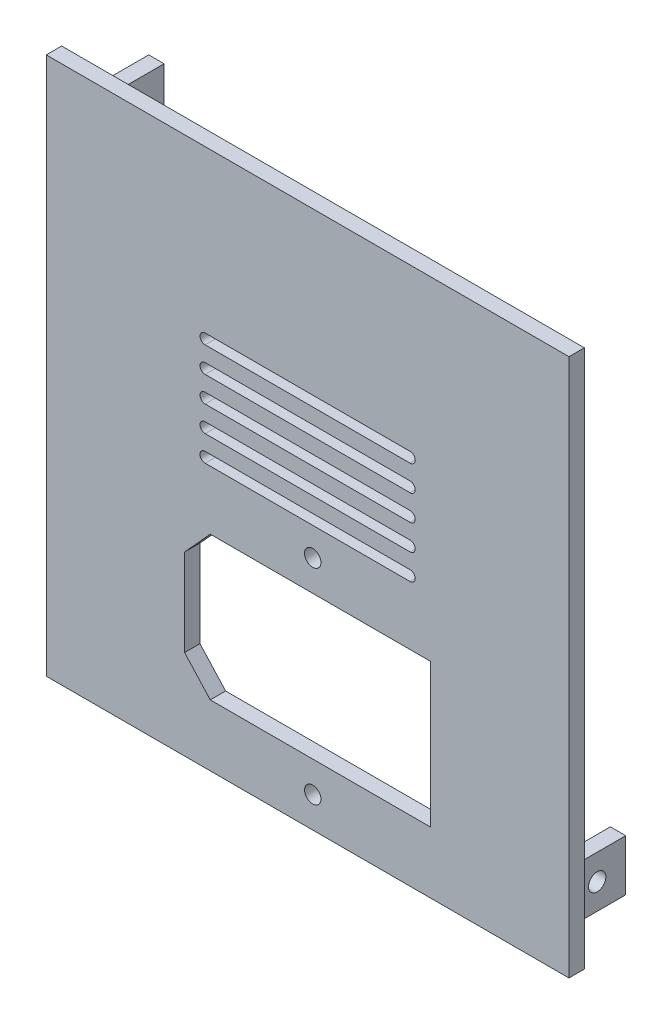
from build123d import *

# Parameters (mm, degrees)
SKETCH2_W            = 102
SKETCH2_H            = 105
BOSS_EXTRUDE1_DEPTH  = 1.5
CUT_EXTRUDE1_DEPTH   = 10
CUT_EXTRUDE2_DEPTH   = 10
SKETCH5_W            = 3
SKETCH5_H            = 10
BOSS_EXTRUDE2_DEPTH  = 17
FILLET1_R            = 3
M3_CLEARANCE_HOLE1_D = 3.4
SKETCH8_W            = 3
SKETCH8_H            = 10
BOSS_EXTRUDE3_DEPTH  = 15
M3_CLEARANCE_HOLE2_D = 3.4
FILLET2_R            = 3
FILLET3_R            = 1
FILLET1_OF_MIRROR1_R = 3
M3_CLEARANCE_HOLE3_D = 3.2


with BuildPart() as part:
    # Sketch2 → Boss-Extrude1 (new, symmetric)
    with BuildSketch(Plane.XY):
        Rectangle(SKETCH2_W, SKETCH2_H)
    extrude(amount=BOSS_EXTRUDE1_DEPTH, both=True)

    # Sketch3 → Cut-Extrude1 (cut)
    with BuildSketch(Plane.XY.offset(1.5)):
        with BuildLine():
            Line((-20, 1), (20, 1))
            ThreePointArc((20, 1), (21, 0), (20, -1))
            Line((20, -1), (-20, -1))
            ThreePointArc((-20, -1), (-21, 0), (-20, 1))
        make_face()
        with BuildLine():
            Line((-20, 6), (20, 6))
            ThreePointArc((20, 6), (21, 5), (20, 4))
            Line((20, 4), (-20, 4))
            ThreePointArc((-20, 4), (-21, 5), (-20, 6))
        make_face()
        with BuildLine():
            Line((-20, 11), (20, 11))
            ThreePointArc((20, 11), (21, 10), (20, 9))
            Line((20, 9), (-20, 9))
            ThreePointArc((-20, 9), (-21, 10), (-20, 11))
        make_face()
        with BuildLine():
            Line((-20, 16), (20, 16))
            ThreePointArc((20, 16), (21, 15), (20, 14))
            Line((20, 14), (-20, 14))
            ThreePointArc((-20, 14), (-21, 15), (-20, 16))
        make_face()
        with BuildLine():
            Line((-20, 21), (20, 21))
            ThreePointArc((20, 21), (21, 20), (20, 19))
            Line((20, 19), (-20, 19))
            ThreePointArc((-20, 19), (-21, 20), (-20, 21))
        make_face()
    extrude(amount=-CUT_EXTRUDE1_DEPTH, mode=Mode.SUBTRACT)

    # Sketch4 → Cut-Extrude2 (cut)
    with BuildSketch(Plane.XY.offset(1.5)):
        Polygon((-19, -12.5), (24, -12.5), (24, -40.5), (-19, -40.5), (-24, -35), (-24, -18), align=None)
    extrude(amount=-CUT_EXTRUDE2_DEPTH, mode=Mode.SUBTRACT)

    # Sketch5 → Boss-Extrude2 (add)
    with BuildSketch(Plane(origin=(0, 0, -1.5), x_dir=(-1, 0, 0), z_dir=(0, 0, -1))):
        with Locations((49.5, -37.5)):
            Rectangle(SKETCH5_W, SKETCH5_H)
    boss_extrude2 = extrude(amount=BOSS_EXTRUDE2_DEPTH)

    # Fillet1
    fillet1_edges = [part.edges().sort_by_distance(p)[0] for p in [
        (-49.5, -32.5, -1.5),
        (-48, -37.5, -1.5),
        (-49.5, -42.5, -1.5),
    ]]
    fillet(fillet1_edges, radius=FILLET1_R)

    # M3 Clearance Hole1 (through all)
    with Locations(Plane.ZY.offset(51)):
        with Locations((-13.5, -37.5)):
            m3_clearance_hole1 = Hole(M3_CLEARANCE_HOLE1_D / 2)

    # Sketch8 → Boss-Extrude3 (add)
    with BuildSketch(Plane(origin=(0, 0, -1.5), x_dir=(-1, 0, 0), z_dir=(0, 0, -1))):
        with Locations((-42.58, -45.91)):
            Rectangle(SKETCH8_W, SKETCH8_H)
    extrude(amount=BOSS_EXTRUDE3_DEPTH)

    # M3 Clearance Hole2 (through all)
    with Locations(Plane(origin=(44.08, 0, 0), x_dir=(0, 0, -1), z_dir=(1, 0, 0))):
        with Locations((10.93, -45.91)):
            Hole(M3_CLEARANCE_HOLE2_D / 2)

    # Fillet2
    fillet2_edges = [part.edges().sort_by_distance(p)[0] for p in [
        (41.08, -45.91, -1.5),
        (42.58, -40.91, -1.5),
        (44.08, -45.91, -1.5),
    ]]
    fillet(fillet2_edges, radius=FILLET2_R)

    # Fillet3
    fillet3_edges = [part.edges().sort_by_distance(p)[0] for p in [
        (42.58, -50.91, -1.5),
    ]]
    fillet(fillet3_edges, radius=FILLET3_R)

    # Mirror1: Boss-Extrude2, M3 Clearance Hole1 across plane
    add(boss_extrude2.mirror(Plane.ZX))
    add(m3_clearance_hole1.mirror(Plane.ZX), mode=Mode.SUBTRACT)

    # Fillet1 of Mirror1
    fillet1_of_mirror1_edges = [part.edges().sort_by_distance(p)[0] for p in [
        (-49.5, 32.5, -1.5),
        (-48, 37.5, -1.5),
        (-49.5, 42.5, -1.5),
    ]]
    fillet(fillet1_of_mirror1_edges, radius=FILLET1_OF_MIRROR1_R)

    # M3 Clearance Hole3 (through all)
    with Locations(Plane(origin=(0, 0, -1.5), x_dir=(-1, 0, 0), z_dir=(0, 0, -1))):
        with Locations((-1, -6.5), (-1, -46.5)):
            Hole(M3_CLEARANCE_HOLE3_D / 2)


solid = part.part
